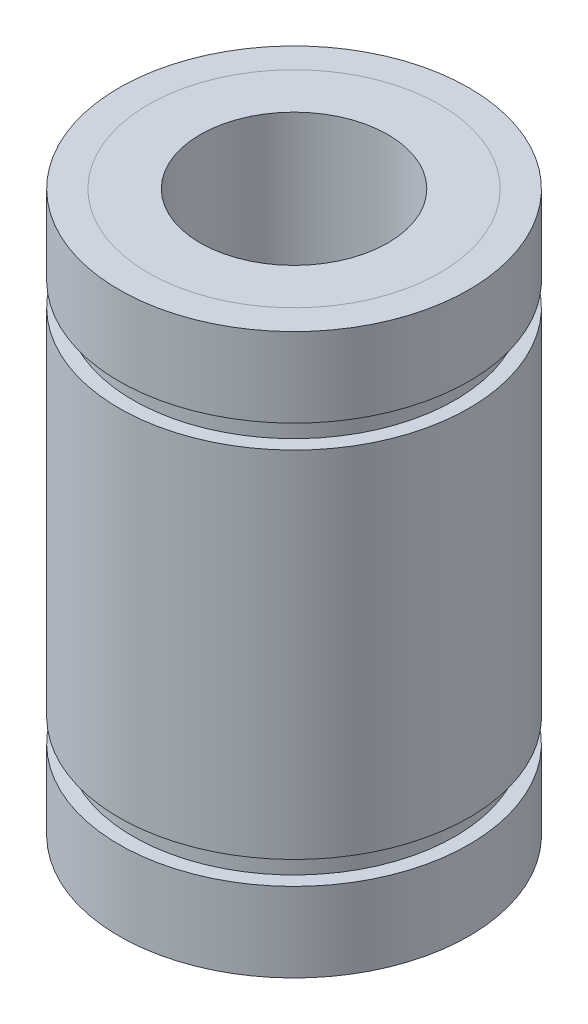
from build123d import *

# Parameters (mm, degrees)
CROQUIS2_R              = 6.25
CORTAR_EXTRUIR1_DEPTH   = 27.239283527
CROQUIS3_R              = 6.25
CROQUIS3_R_2            = 4.025
SALIENTE_EXTRUIR1_DEPTH = 24


with BuildPart() as part:
    # Croquis1 → Revolución2 (revolve)
    with BuildSketch(Plane.XY, mode=Mode.PRIVATE) as revoluci_n2_sk:
        Polygon((0, -12), (0, 12), (7.5, 12), (7.5, 8.6), (6.9, 8.6), (6.9, 7.6), (7.5, 7.6), (7.5, -7.6), (6.9, -7.6), (6.9, -8.6), (7.5, -8.6), (7.5, -12), align=None)
    revolve(revoluci_n2_sk.sketch.rotate(Axis((0, -12, 0), (0, 1, 0)), 90), axis=Axis((0, -12, 0), (0, 1, 0)))

    # Croquis2 → Cortar-Extruir1 (cut, through all)
    with BuildSketch(Plane(origin=(0, 12, 0), x_dir=(1, 0, 0), z_dir=(0, 1, 0))):
        with Locations(Location((0, 0, 0), (0, 0, 270))):
            Circle(CROQUIS2_R)
    extrude(amount=-CORTAR_EXTRUIR1_DEPTH, mode=Mode.SUBTRACT)


with BuildPart() as body_2:
    # Croquis3 → Saliente-Extruir1 (new body)
    with BuildSketch(Plane(origin=(0, 12, 0), x_dir=(1, 0, 0), z_dir=(0, 1, 0))):
        with Locations(Location((0, 0, 0), (0, 0, 270))):
            Circle(CROQUIS3_R)
        with Locations(Location((0, 0, 0), (0, 0, 270))):
            Circle(CROQUIS3_R_2, mode=Mode.SUBTRACT)
    extrude(amount=-SALIENTE_EXTRUIR1_DEPTH)


solid = Compound([part.part, body_2.part])
